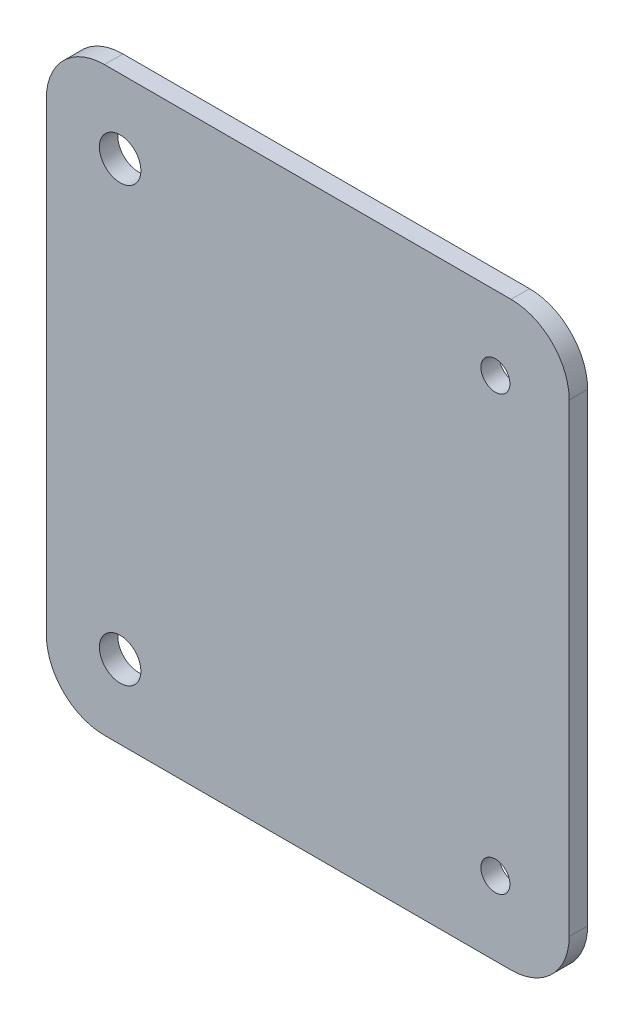
from build123d import *

# Parameters (mm, degrees)
BOSS_EXTRUDE1_START = 15.549813
SKETCH1_W           = 90
SKETCH1_H           = 100
SKETCH1_R           = 2.5
SKETCH1_R_2         = 3.57
BOSS_EXTRUDE1_DEPTH = 3.18
FILLET1_R           = 10


with BuildPart() as part:
    # Sketch1 → Boss-Extrude1 (new body)
    with BuildSketch(Plane.XY.offset(BOSS_EXTRUDE1_START)):
        with Locations((0, -5)):
            Rectangle(SKETCH1_W, SKETCH1_H)
        with Locations((32.3, -42.3)):
            Circle(SKETCH1_R, mode=Mode.SUBTRACT)
        with Locations((-32.3, -42.3)):
            Circle(SKETCH1_R_2, mode=Mode.SUBTRACT)
        with Locations((-32.3, 32.3)):
            Circle(SKETCH1_R_2, mode=Mode.SUBTRACT)
        with Locations((32.3, 32.3)):
            Circle(SKETCH1_R, mode=Mode.SUBTRACT)
    extrude(amount=BOSS_EXTRUDE1_DEPTH)

    # Fillet1
    fillet1_edges = [part.edges().sort_by_distance(p)[0] for p in [
        (-45, 45, 17.139813),
        (45, 45, 17.139813),
        (45, -55, 17.139813),
        (-45, -55, 17.139813),
    ]]
    fillet(fillet1_edges, radius=FILLET1_R)


solid = part.part
